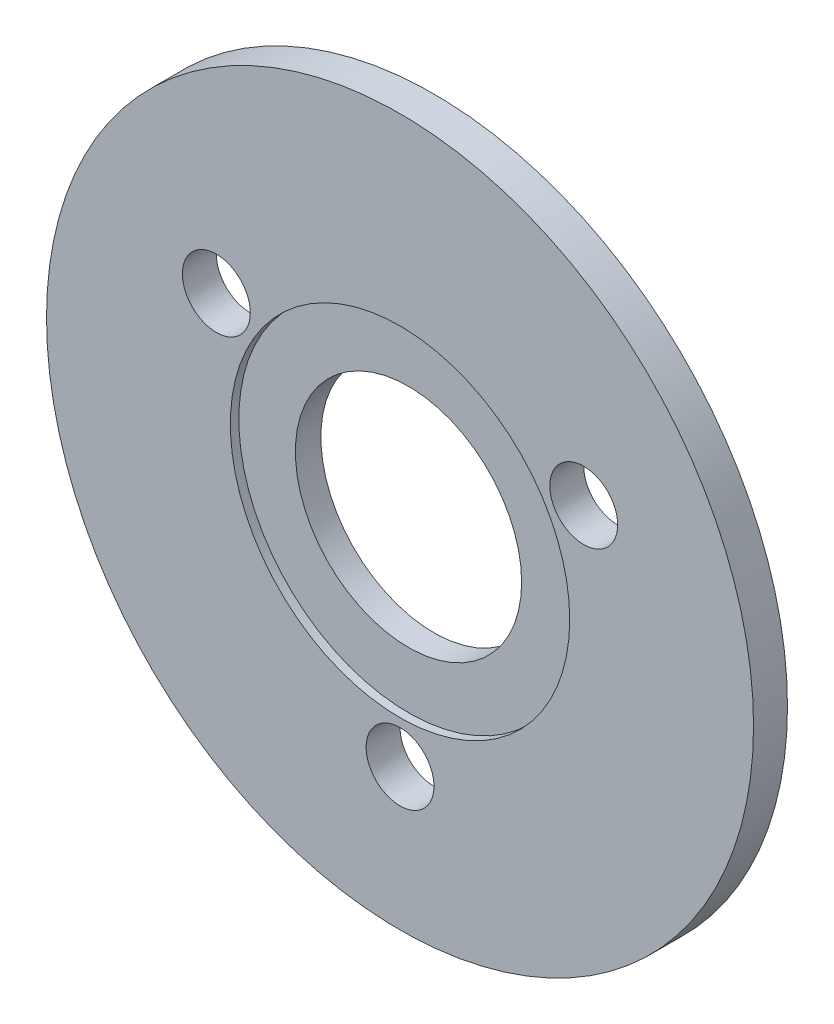
from build123d import *

# Parameters (mm, degrees)
SKETCH_1_R          = 12.5
SKETCH_1_R_2        = 4
SKETCH_1_R_3        = 1.2
EXTRUDE_1_DEPTH     = 1.2
SKETCH_3_R          = 6
CUT_EXTRUDE_2_DEPTH = 0.3


with BuildPart() as part:
    # 草图1 → 凸台-拉伸1 (new body)
    with BuildSketch(Plane.XY):
        Circle(SKETCH_1_R)
        Circle(SKETCH_1_R_2, mode=Mode.SUBTRACT)
        with Locations((0, -7.5)):
            Circle(SKETCH_1_R_3, mode=Mode.SUBTRACT)
        with Locations((-6.495190528, 3.75)):
            Circle(SKETCH_1_R_3, mode=Mode.SUBTRACT)
        with Locations((6.495190528, 3.75)):
            Circle(SKETCH_1_R_3, mode=Mode.SUBTRACT)
    extrude(amount=EXTRUDE_1_DEPTH)

    # 草图3 → 切除-拉伸2 (cut)
    with BuildSketch(Plane.XY.offset(1.2)):
        Circle(SKETCH_3_R)
    extrude(amount=-CUT_EXTRUDE_2_DEPTH, mode=Mode.SUBTRACT)


solid = part.part
